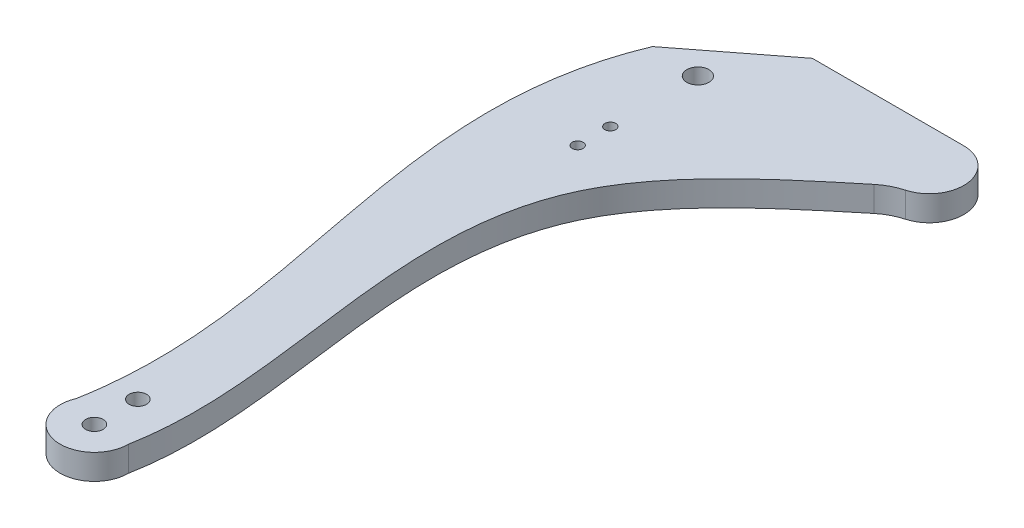
from build123d import *

# Parameters (mm, degrees)
SKETCH1_R           = 1.975
SKETCH1_R_2         = 1.554999938
SKETCH1_R_3         = 0.97
BOSS_EXTRUDE1_DEPTH = 4.5


with BuildPart() as part:
    # Sketch1 → Boss-Extrude1 (new body)
    with BuildSketch(Plane(origin=(0, 0, 0), x_dir=(1, 0, 0), z_dir=(0, 1, 0))):
        with BuildLine():
            Line((-16.144899663, 8.454003274), (10.877745108, 8.454003274))
            ThreePointArc((10.877745108, 8.454003274), (16.961539544, 3.139522495), (12.51277209, -3.603231306))
            ThreePointArc((12.51277209, -3.603231306), (10.56783567, -4.367093581), (8.824099884, -5.518461795))
            add(Edge.make_bspline(
                [(8.824099884, -5.518461795), (4.932532744, -8.718832913), (-4.696045283, -16.58586855), (-31.489086781, -46.943790059), (-12.894682963, -87.326546642), (-17.517744483, -112.138995974)],
                knots=[0.023478108, 0.023478108, 0.023478108, 0.023478108, 0.154944007, 0.330832674, 1, 1, 1, 1], degree=3))
            ThreePointArc((-17.517744483, -112.138995974), (-24.835663445, -118.119615453), (-29.239494185, -109.757437382))
            add(Edge.make_bspline(
                [(-32.217521916, -3.987452131), (-42.206514906, -27.827820505), (-29.561370115, -63.982250345), (-27.390169054, -99.665041987), (-29.239494185, -109.757437382)],
                knots=[0, 0, 0, 0, 0.696305279, 0.977824201, 0.977824201, 0.977824201, 0.977824201], degree=3))
            Line((-32.217521916, -3.987452131), (-16.144899663, 8.454003274))
        make_face()
        with Locations(Location((-23.620555115, -4.478995902, 0), (0, 0, 270))):
            Circle(SKETCH1_R, mode=Mode.SUBTRACT)
        with Locations(Location((-23.620555115, -112.138995974, 0), (0, 0, 270))):
            Circle(SKETCH1_R_2, mode=Mode.SUBTRACT)
        with Locations(Location((-23.620555115, -104.378996, 0), (0, 0, 270))):
            Circle(SKETCH1_R_2, mode=Mode.SUBTRACT)
        with Locations(Location((-23.620555115, -25.918995902, 0), (0, 0, 270))):
            Circle(SKETCH1_R_3, mode=Mode.SUBTRACT)
        with Locations(Location((-23.620555115, -20.098995902, 0), (0, 0, 270))):
            Circle(SKETCH1_R_3, mode=Mode.SUBTRACT)
    extrude(amount=BOSS_EXTRUDE1_DEPTH)


solid = part.part
